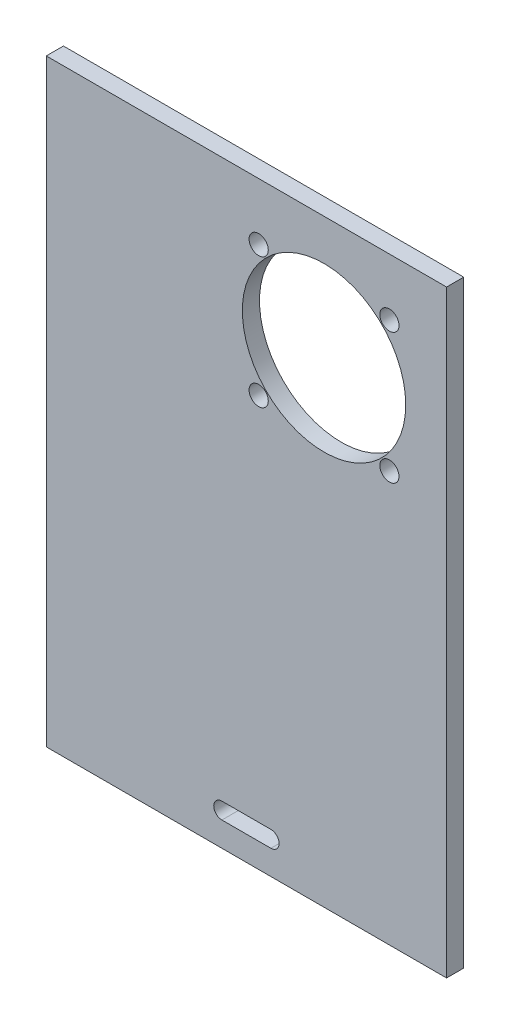
from build123d import *

# Parameters (mm, degrees)
SKETCH1_W           = 98
SKETCH1_H           = 146.5
BOSS_EXTRUDE1_DEPTH = 4.2
SKETCH3_R           = 20
CUT_EXTRUDE2_DEPTH  = 10
SKETCH4_R           = 2.35
CUT_EXTRUDE3_DEPTH  = 10
CUT_EXTRUDE5_DEPTH  = 131.021293634


with BuildPart() as part:
    # Sketch1 → Boss-Extrude1 (new body)
    with BuildSketch(Plane.XY):
        with Locations((24.233695652, -34.10326087)):
            Rectangle(SKETCH1_W, SKETCH1_H)
    extrude(amount=BOSS_EXTRUDE1_DEPTH)

    # Sketch3 → Cut-Extrude2 (cut)
    with BuildSketch(Plane.XY.offset(4.2)):
        with Locations((43.233695652, 9.14673913)):
            Circle(SKETCH3_R)
    extrude(amount=-CUT_EXTRUDE2_DEPTH, mode=Mode.SUBTRACT)

    # Sketch4 → Cut-Extrude3 (cut)
    with BuildSketch(Plane.XY.offset(4.2)):
        with Locations((27.233695652, 25.14673913)):
            Circle(SKETCH4_R)
        with Locations((59.233695652, 25.14673913)):
            Circle(SKETCH4_R)
        with Locations((59.233695652, -6.85326087)):
            Circle(SKETCH4_R)
        with Locations((27.233695652, -6.85326087)):
            Circle(SKETCH4_R)
    extrude(amount=-CUT_EXTRUDE3_DEPTH, mode=Mode.SUBTRACT)

    # Sketch6 → Cut-Extrude5 (cut, through all)
    with BuildSketch(Plane.XY.offset(4.2)):
        with BuildLine():
            Line((18.233695652, -97.35326087), (30.233695652, -97.35326087))
            ThreePointArc((30.233695652, -97.35326087), (32.233695652, -99.35326087), (30.233695652, -101.35326087))
            Line((30.233695652, -101.35326087), (18.233695652, -101.35326087))
            ThreePointArc((18.233695652, -101.35326087), (16.233695652, -99.35326087), (18.233695652, -97.35326087))
        make_face()
    extrude(amount=-CUT_EXTRUDE5_DEPTH, mode=Mode.SUBTRACT)


solid = part.part
